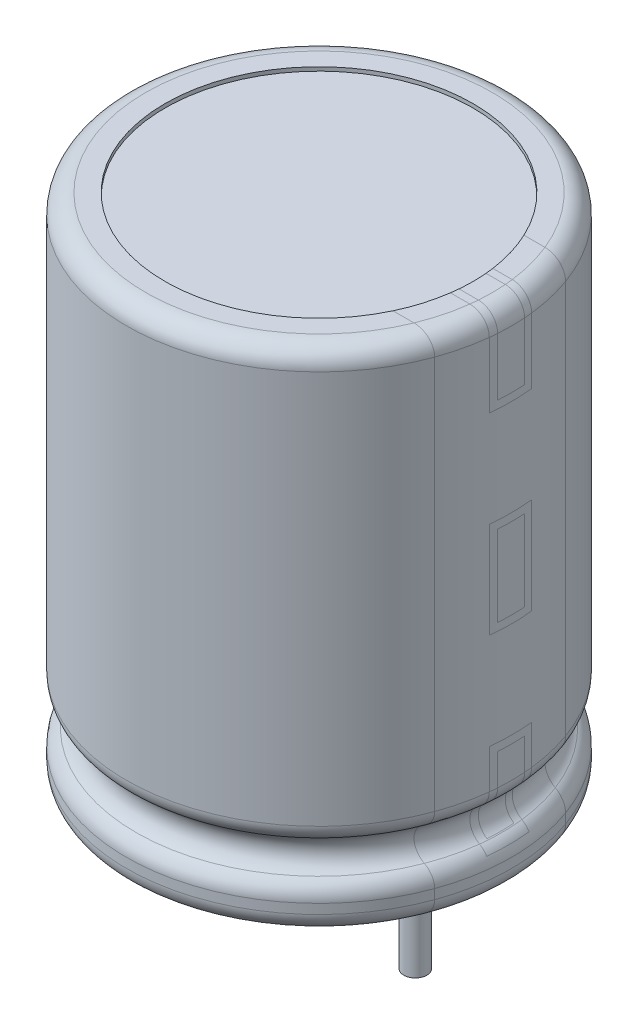
from build123d import *

# Parameters (mm, degrees)
BOSS_EXTRUDE1_DEPTH        = 1
BOSS_EXTRUDE1_DEPTH_BACK   = 3
SKETCH1_R                  = 0.3
BOSS_EXTRUDE1_2_DEPTH      = 1
BOSS_EXTRUDE1_2_DEPTH_BACK = 3


with BuildPart() as part:
    # Sketch1 → Boss-Extrude1 (new, two sides: drawn at the far end of the back side and taken through both)
    with BuildSketch(Plane(origin=(0, 0, 0), x_dir=(1, 0, 0), z_dir=(0, 1, 0)).offset(-BOSS_EXTRUDE1_DEPTH_BACK)):
        with Locations(Location((-2.5, 0, 0), (0, 0, 270))):
            Circle(SKETCH1_R)
    extrude(amount=BOSS_EXTRUDE1_DEPTH + BOSS_EXTRUDE1_DEPTH_BACK)



with BuildPart() as body_2:
    # Sketch1 → Boss-Extrude1 2 (new, two sides: drawn at the far end of the back side and taken through both)
    with BuildSketch(Plane(origin=(0, 0, 0), x_dir=(1, 0, 0), z_dir=(0, 1, 0)).offset(-BOSS_EXTRUDE1_2_DEPTH_BACK)):
        with Locations(Location((2.5, 0, 0), (0, 0, 90))):
            Circle(SKETCH1_R)
    extrude(amount=BOSS_EXTRUDE1_2_DEPTH + BOSS_EXTRUDE1_2_DEPTH_BACK)


with BuildPart() as part_1:
    add(part.part)

    add(body_2.part)  # Revolve1 merges body 2
    # Sketch3 → Revolve1 (revolve)
    with BuildSketch(Plane.XY):
        with BuildLine():
            Line((5, 0.5), (5, 0.75))
            ThreePointArc((5, 0.75), (4.933012702, 1), (4.75, 1.183012702))
            ThreePointArc((4.75, 1.183012702), (4.5, 1.616025404), (4.75, 2.049038106))
            ThreePointArc((4.75, 2.049038106), (4.933012702, 2.232050808), (5, 2.482050808))
            Line((5, 2.482050808), (5, 12.7))
            ThreePointArc((5, 12.7), (4.853553391, 13.053553391), (4.5, 13.2))
            Line((4.5, 13.2), (4, 13.2))
            Line((4, 13.2), (4, 13.1))
            Line((4, 13.1), (0, 13.1))
            Line((0, 13.1), (0, 0.1))
            Line((0, 0.1), (4, 0.1))
            Line((4, 0.1), (4, 0))
            Line((4, 0), (4.5, 0))
            ThreePointArc((4.5, 0), (4.853553391, 0.146446609), (5, 0.5))
        make_face()
    revolve(axis=Axis((0, 0.1, 0), (0, 1, 0)))


solid = part_1.part
